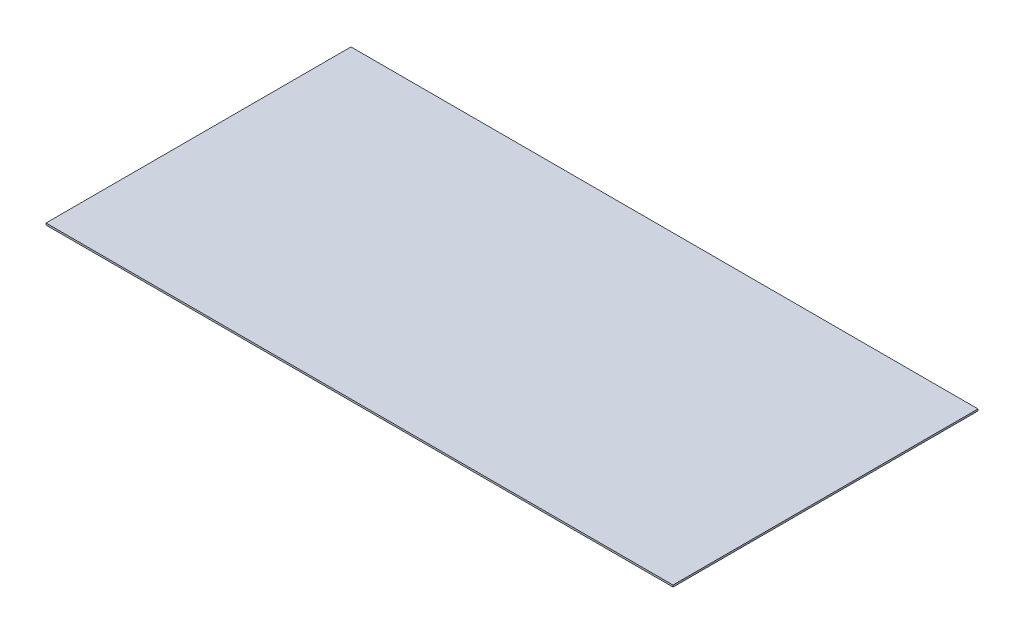
from build123d import *

# Parameters (mm, degrees)
SKETCH1_W           = 1028
SKETCH1_H           = 500
BOSS_EXTRUDE1_DEPTH = 3


with BuildPart() as part:
    # Sketch1 → Boss-Extrude1 (new body)
    with BuildSketch(Plane(origin=(0, 0, 0), x_dir=(1, 0, 0), z_dir=(0, 1, 0))):
        with Locations((-514, -250)):
            Rectangle(SKETCH1_W, SKETCH1_H)
    extrude(amount=BOSS_EXTRUDE1_DEPTH)


solid = part.part
